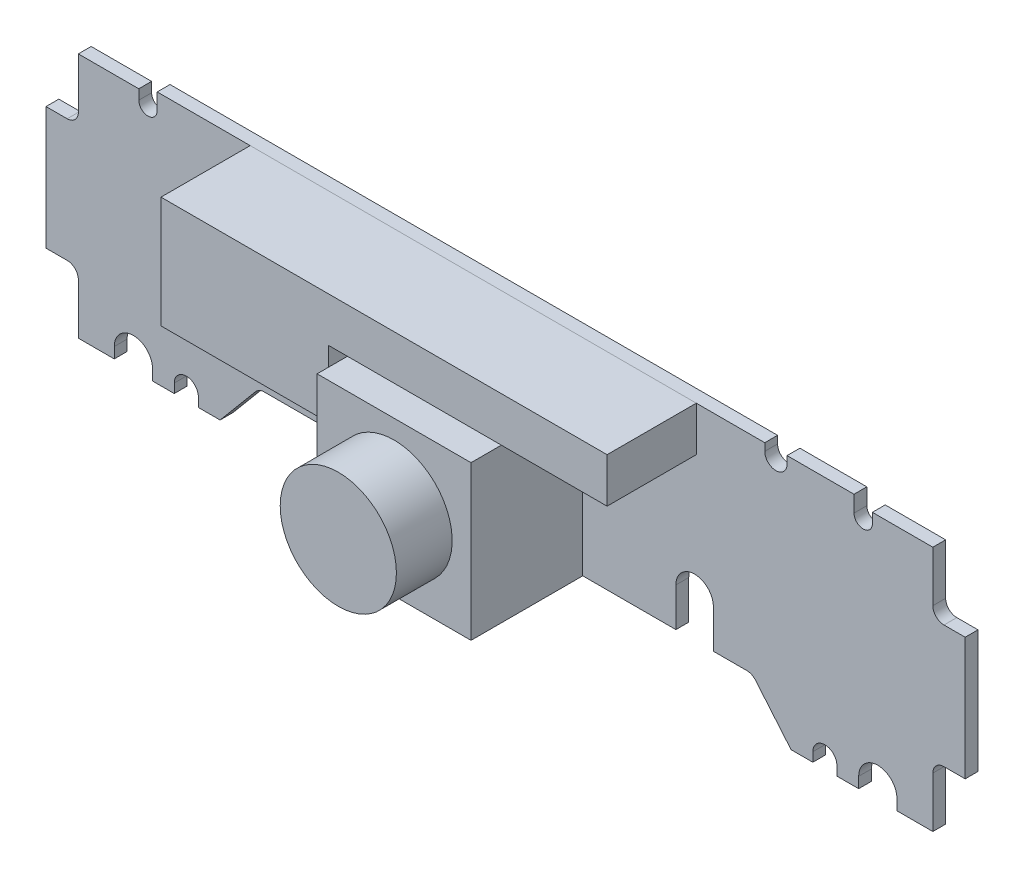
from build123d import *

# Parameters (mm, degrees)
BOSS_EXTRUDE1_DEPTH = 1.15
SKETCH2_R           = 5.21
BOSS_EXTRUDE2_DEPTH = 15
SKETCH3_W           = 13.8
SKETCH3_H           = 13.8
BOSS_EXTRUDE3_DEPTH = 10
FILLET1_R           = 1
BOSS_EXTRUDE4_DEPTH = 8


with BuildPart() as part:
    # Sketch1 → Boss-Extrude1 (new body)
    with BuildSketch(Plane.XY):
        with BuildLine():
            Line((38.310144928, -11.04), (38.310144928, -5.5))
            Line((38.310144928, -5.5), (41.210144928, -5.5))
            Line((41.210144928, -5.5), (41.210144928, 5.5))
            Line((41.210144928, 5.5), (38.310144928, 5.5))
            Line((38.310144928, 5.5), (38.310144928, 11.04))
            Line((38.310144928, 11.04), (32.890144928, 11.04))
            Line((32.890144928, 11.04), (32.890144928, 10.155))
            ThreePointArc((32.890144928, 10.155), (32.065144928, 9.33), (31.240144928, 10.155))
            Line((31.240144928, 10.155), (31.240144928, 11.62))
            Line((31.240144928, 11.62), (25.240144928, 11.62))
            Line((25.240144928, 11.62), (25.240144928, 10.95))
            ThreePointArc((25.240144928, 10.95), (24.240144928, 9.95), (23.240144928, 10.95))
            Line((23.240144928, 10.95), (23.240144928, 11.62))
            Line((23.240144928, 11.62), (-31.240144928, 11.62))
            Line((-31.240144928, 11.62), (-31.240144928, 10.155))
            ThreePointArc((-31.240144928, 10.155), (-32.065144928, 9.33), (-32.890144928, 10.155))
            Line((-32.890144928, 10.155), (-32.890144928, 11.04))
            Line((-32.890144928, 11.04), (-38.310144928, 11.04))
            Line((-38.310144928, 11.04), (-38.310144928, 5.5))
            Line((-38.310144928, 5.5), (-41.210144928, 5.5))
            Line((-41.210144928, 5.5), (-41.210144928, -5.5))
            Line((-41.210144928, -5.5), (-38.310144928, -5.5))
            Line((-38.310144928, -5.5), (-38.310144928, -11.04))
            Line((-38.310144928, -11.04), (-35.090144928, -11.04))
            Line((-35.090144928, -11.04), (-35.090144928, -10.074999983))
            ThreePointArc((-35.090144928, -10.074999983), (-33.375144928, -8.36), (-31.660144928, -10.074999983))
            Line((-31.660144928, -10.074999983), (-31.660144928, -11.04))
            Line((-31.660144928, -11.04), (-29.710144928, -11.04))
            Line((-29.710144928, -11.04), (-29.710144928, -10.22))
            ThreePointArc((-29.710144928, -10.22), (-28.630144928, -9.14), (-27.550144928, -10.22))
            Line((-27.550144928, -10.22), (-27.550144928, -11.04))
            Line((-27.550144928, -11.04), (-25.600144928, -11.04))
            Line((-25.600144928, -11.04), (-22.109490462, -6.88))
            Line((-22.109490462, -6.88), (15.270144928, -6.88))
            Line((15.270144928, -6.88), (15.270144928, -3.41))
            ThreePointArc((15.270144928, -3.41), (16.950144928, -1.73), (18.630144928, -3.41))
            Line((18.630144928, -3.41), (18.630144928, -6.88))
            Line((18.630144928, -6.88), (22.109490462, -6.88))
            Line((22.109490462, -6.88), (25.600144928, -11.04))
            Line((25.600144928, -11.04), (27.550144928, -11.04))
            Line((27.550144928, -11.04), (27.550144928, -10.219999678))
            ThreePointArc((27.550144928, -10.219999678), (28.630144928, -9.14), (29.710144928, -10.219999678))
            Line((29.710144928, -10.219999678), (29.710144928, -11.04))
            Line((29.710144928, -11.04), (31.660144928, -11.04))
            Line((31.660144928, -11.04), (31.660144928, -10.075))
            ThreePointArc((31.660144928, -10.075), (33.375144928, -8.36), (35.090144928, -10.075))
            Line((35.090144928, -10.075), (35.090144928, -11.04))
            Line((35.090144928, -11.04), (38.310144928, -11.04))
        make_face()
    extrude(amount=BOSS_EXTRUDE1_DEPTH)

    # Sketch2 → Boss-Extrude2 (add)
    with BuildSketch(Plane.XY.offset(1.15)):
        Circle(SKETCH2_R)
    extrude(amount=BOSS_EXTRUDE2_DEPTH)

    # Sketch3 → Boss-Extrude3 (add)
    with BuildSketch(Plane.XY.offset(1.15)):
        Rectangle(SKETCH3_W, SKETCH3_H)
    extrude(amount=BOSS_EXTRUDE3_DEPTH)

    # Fillet1
    fillet1_edges = [part.edges().sort_by_distance(p)[0] for p in [
        (22.109490462, -6.88, 0.575),
        (-22.109490462, -6.88, 0.575),
        (-38.310144928, -5.5, 0.575),
        (-38.310144928, 5.5, 0.575),
        (38.310144928, 5.5, 0.575),
        (38.310144928, -5.5, 0.575),
    ]]
    fillet(fillet1_edges, radius=FILLET1_R)


with BuildPart() as body_2:
    # Sketch4 → Boss-Extrude4 (new body)
    with BuildSketch(Plane.XY.offset(1.15)):
        Polygon((-7.9, 7.62), (-7.9, 1.62), (-22.9, 1.62), (-22.9, 11.62), (17.1, 11.62), (17.1, 7.62), align=None)
    extrude(amount=BOSS_EXTRUDE4_DEPTH)


solid = Compound([part.part, body_2.part])
